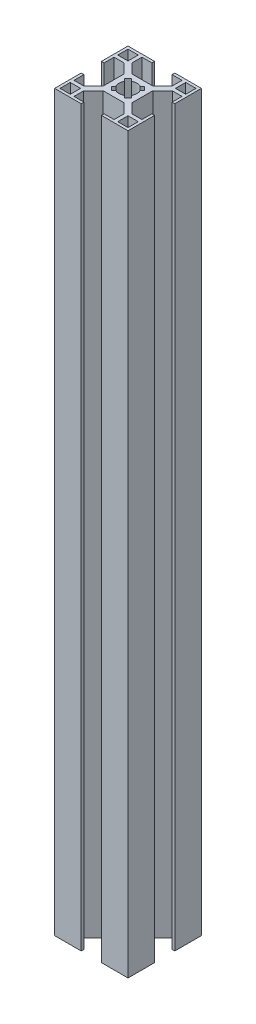
from build123d import *

# Parameters (mm, degrees)
CROQUIS2_W              = 4.2
CROQUIS2_H              = 4.2
SALIENTE_EXTRUIR1_DEPTH = 300


with BuildPart() as part:
    # Croquis2 → Saliente-Extruir1 (new body)
    with BuildSketch(Plane(origin=(0, 0, 0), x_dir=(1, 0, 0), z_dir=(0, 1, 0))):
        Polygon((-37.373217156, 24.271112291), (-26.498217156, 24.271112291), (-26.498217156, 23.171112291), (-30.573217156, 23.171112291), (-30.573217156, 19.168168566), (-26.586160881, 15.181112291), (-18.160273431, 15.181112291), (-14.173217156, 19.168168566), (-14.173217156, 23.171112291), (-18.248217156, 23.171112291), (-18.248217156, 24.271112291), (-7.373217156, 24.271112291), (-7.373217156, 13.396112291), (-8.473217156, 13.396112291), (-8.473217156, 17.471112291), (-12.476160881, 17.471112291), (-16.463217156, 13.484056016), (-16.463217156, 5.058168566), (-12.476160881, 1.071112291), (-8.473217156, 1.071112291), (-8.473217156, 5.146112291), (-7.373217156, 5.146112291), (-7.373217156, -5.728887709), (-18.248217156, -5.728887709), (-18.248217156, -4.628887709), (-14.173217156, -4.628887709), (-14.173217156, -0.625943984), (-18.160273431, 3.361112291), (-26.586160881, 3.361112291), (-30.573217156, -0.625943984), (-30.573217156, -4.628887709), (-26.498217156, -4.628887709), (-26.498217156, -5.728887709), (-37.373217156, -5.728887709), (-37.373217156, 5.146112291), (-36.273217156, 5.146112291), (-36.273217156, 1.071112291), (-32.270273431, 1.071112291), (-28.283217156, 5.058168566), (-28.283217156, 13.484056016), (-32.270273431, 17.471112291), (-36.273217156, 17.471112291), (-36.273217156, 13.396112291), (-37.373217156, 13.396112291), align=None)
        with Locations((-10.573217156, 21.071112291)):
            Rectangle(CROQUIS2_W, CROQUIS2_H, mode=Mode.SUBTRACT)
        with Locations((-34.173217156, -2.528887709)):
            Rectangle(CROQUIS2_W, CROQUIS2_H, mode=Mode.SUBTRACT)
        with Locations((-34.173217156, 21.071112291)):
            Rectangle(CROQUIS2_W, CROQUIS2_H, mode=Mode.SUBTRACT)
        with Locations((-10.573217156, -2.528887709)):
            Rectangle(CROQUIS2_W, CROQUIS2_H, mode=Mode.SUBTRACT)
        with BuildLine():
            Line((-19.165547938, 11.064567946), (-18.248217156, 11.981898728))
            Line((-18.248217156, 11.981898728), (-19.662430718, 13.396112291))
            Line((-19.662430718, 13.396112291), (-20.5797615, 12.478781509))
            ThreePointArc((-20.5797615, 12.478781509), (-22.373217156, 12.946112291), (-24.166672811, 12.478781509))
            Line((-24.166672811, 12.478781509), (-25.084003593, 13.396112291))
            Line((-25.084003593, 13.396112291), (-26.498217156, 11.981898728))
            Line((-26.498217156, 11.981898728), (-25.580886374, 11.064567946))
            ThreePointArc((-25.580886374, 11.064567946), (-26.048217156, 9.271112291), (-25.580886374, 7.477656635))
            Line((-25.580886374, 7.477656635), (-26.498217156, 6.560325853))
            Line((-26.498217156, 6.560325853), (-25.084003593, 5.146112291))
            Line((-25.084003593, 5.146112291), (-24.166672811, 6.063443073))
            ThreePointArc((-24.166672811, 6.063443073), (-22.373217156, 5.596112291), (-20.5797615, 6.063443073))
            Line((-20.5797615, 6.063443073), (-19.662430718, 5.146112291))
            Line((-19.662430718, 5.146112291), (-18.248217156, 6.560325853))
            Line((-18.248217156, 6.560325853), (-19.165547938, 7.477656635))
            ThreePointArc((-19.165547938, 7.477656635), (-18.698217156, 9.271112291), (-19.165547938, 11.064567946))
        make_face(mode=Mode.SUBTRACT)
    extrude(amount=SALIENTE_EXTRUIR1_DEPTH)


solid = part.part
